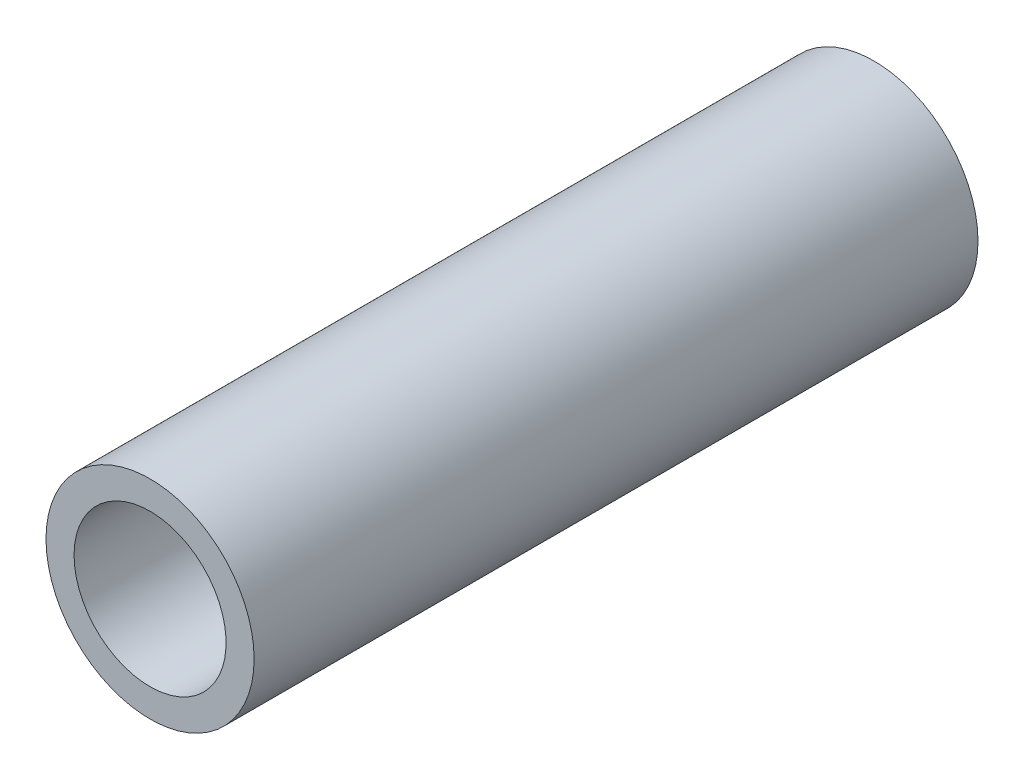
from build123d import *

# Parameters (mm, degrees)
SKETCH2_R           = 5.75
SKETCH2_R_2         = 4.2
BOSS_EXTRUDE1_DEPTH = 40


with BuildPart() as part:
    # Sketch2 → Boss-Extrude1 (new body)
    with BuildSketch(Plane(origin=(0, 0, -40), x_dir=(-1, 0, 0), z_dir=(0, 0, -1))):
        Circle(SKETCH2_R)
        Circle(SKETCH2_R_2, mode=Mode.SUBTRACT)
    extrude(amount=BOSS_EXTRUDE1_DEPTH)


solid = part.part
